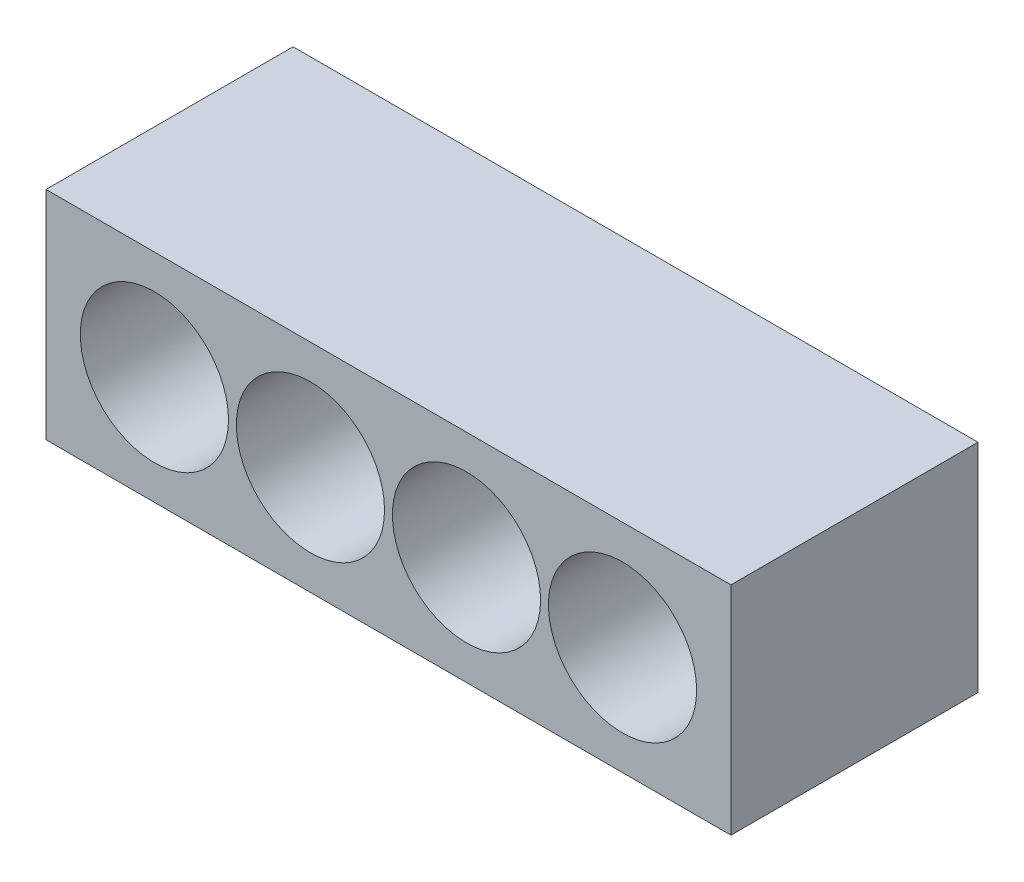
from build123d import *

# Parameters (mm, degrees)
SKETCH1_W      = 399.222993536
SKETCH1_H      = 126.36536723
SKETCH1_R      = 43.182683615
EXTRUDE1_DEPTH = 144


with BuildPart() as part:
    # Sketch1 → Extrude1 (new body)
    with BuildSketch(Plane.XY):
        with Locations((84.765369677, 0)):
            Rectangle(SKETCH1_W, SKETCH1_H)
        with Locations((-51.663443477, 0)):
            Circle(SKETCH1_R, mode=Mode.SUBTRACT)
        with Locations((39.289098626, 0)):
            Circle(SKETCH1_R, mode=Mode.SUBTRACT)
        with Locations((130.241640728, 0)):
            Circle(SKETCH1_R, mode=Mode.SUBTRACT)
        with Locations((221.19418283, 0)):
            Circle(SKETCH1_R, mode=Mode.SUBTRACT)
    extrude(amount=EXTRUDE1_DEPTH)


solid = part.part
